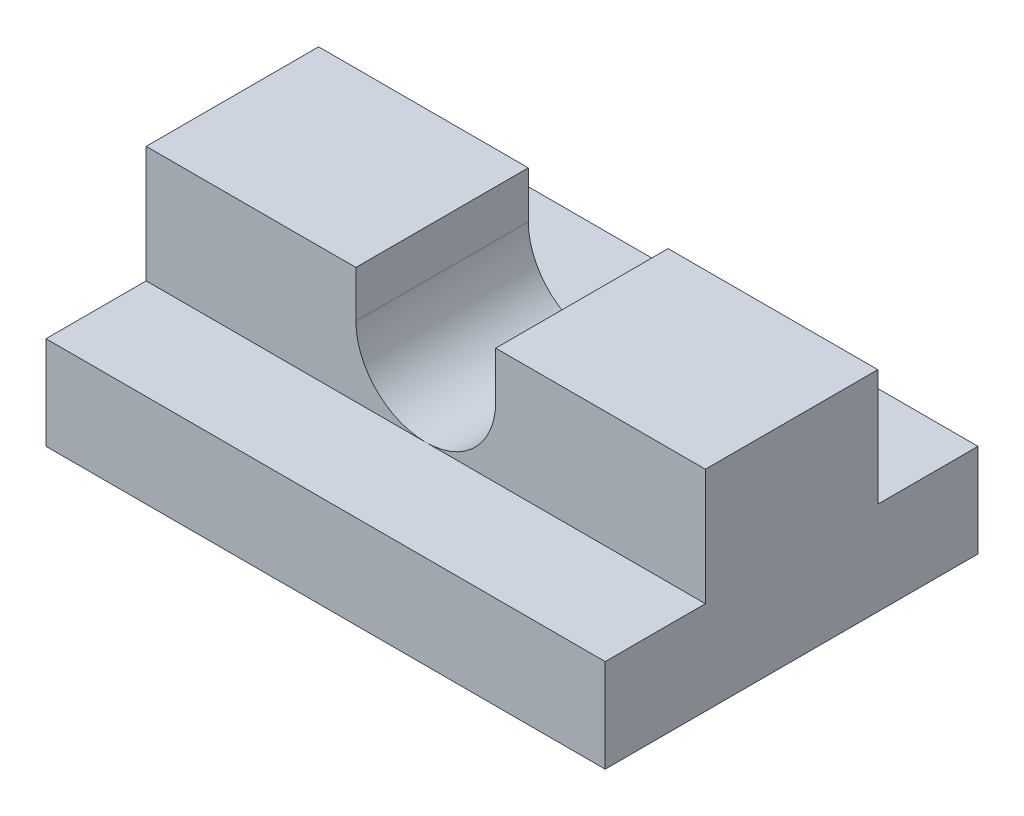
from build123d import *

# Parameters (mm, degrees)
SKETCH1_W           = 12
SKETCH1_H           = 8
BOSS_EXTRUDE1_DEPTH = 2
SKETCH2_W           = 12
SKETCH2_H           = 3.7
BOSS_EXTRUDE2_DEPTH = 2.5
CUT_EXTRUDE1_DEPTH  = 15.088026831


with BuildPart() as part:
    # Sketch1 → Boss-Extrude1 (new body)
    with BuildSketch(Plane(origin=(0, 0, 0), x_dir=(1, 0, 0), z_dir=(0, 1, 0))):
        with Locations((6, 0)):
            Rectangle(SKETCH1_W, SKETCH1_H)
    extrude(amount=BOSS_EXTRUDE1_DEPTH)

    # Sketch2 → Boss-Extrude2 (add)
    with BuildSketch(Plane(origin=(0, 2, 0), x_dir=(1, 0, 0), z_dir=(0, 1, 0))):
        with Locations((6, 0)):
            Rectangle(SKETCH2_W, SKETCH2_H)
    extrude(amount=BOSS_EXTRUDE2_DEPTH)

    # Sketch3 → Cut-Extrude1 (cut, through all)
    with BuildSketch(Plane.XY.offset(1.85)):
        with BuildLine():
            Line((4.5, 3.5), (4.5, 5))
            Line((4.5, 5), (7.5, 5))
            Line((7.5, 5), (7.5, 3.5))
            ThreePointArc((7.5, 3.5), (6, 2), (4.5, 3.5))
        make_face()
    extrude(amount=-CUT_EXTRUDE1_DEPTH, mode=Mode.SUBTRACT)


solid = part.part
